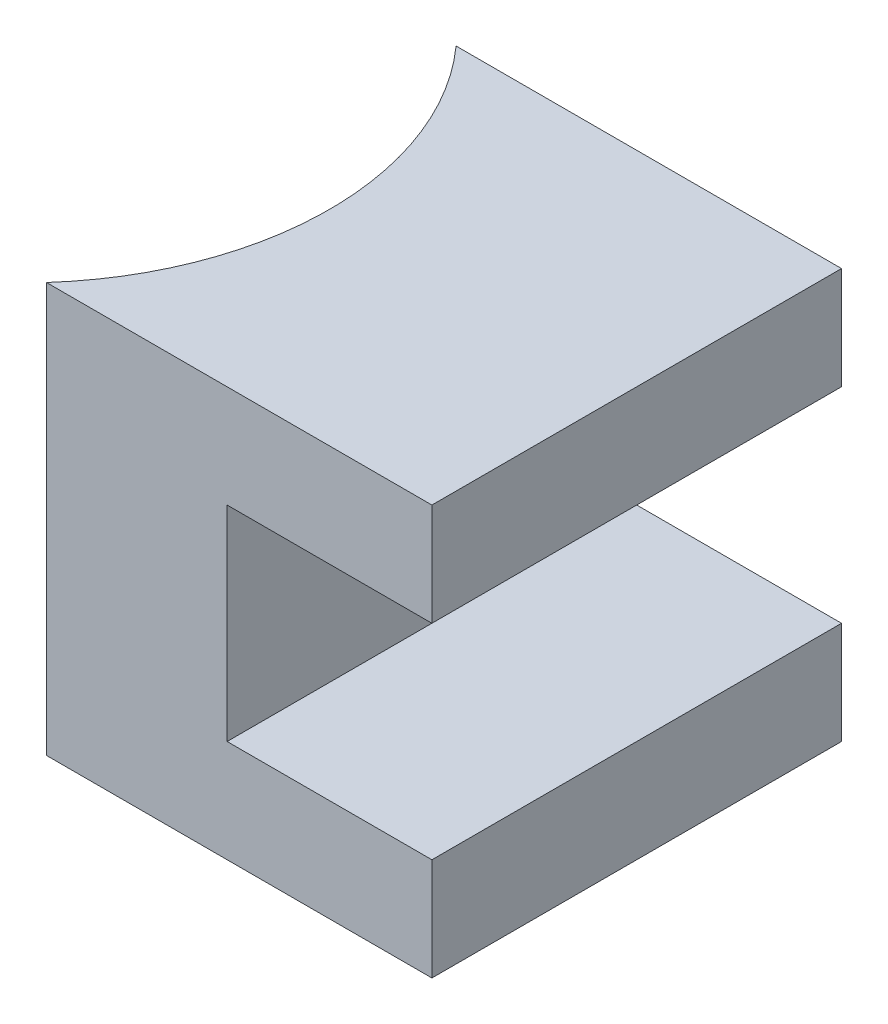
from build123d import *

# Parameters (mm, degrees)
EXTRUDE_1_DEPTH          = 10
CUT_EXTRUDE_1_DEPTH      = 38.416573868
CUT_EXTRUDE_1_DEPTH_BACK = 38.416573868
SKETCH_3_W               = 15.208425039
SKETCH_3_H               = 10


with BuildPart() as part:
    # 草图2 → 凸台-拉伸1 (new, symmetric)
    with BuildSketch(Plane(origin=(0, 0, 0), x_dir=(1, 0, 0), z_dir=(0, 1, 0))):
        with BuildLine():
            Line((11.180339887, 10), (30, 10))
            Line((30, 10), (30, -10))
            Line((30, -10), (11.180339887, -10))
            ThreePointArc((11.180339887, -10), (15, 0), (11.180339887, 10))
        make_face()
    extrude(amount=EXTRUDE_1_DEPTH, both=True)

    # 草图3 → 切除-拉伸1 (cut, two sides: drawn at the far end of the back side and taken through both)
    with BuildSketch(Plane.XY.offset(10).offset(-CUT_EXTRUDE_1_DEPTH_BACK)):
        with Locations((27.60421252, 0)):
            Rectangle(SKETCH_3_W, SKETCH_3_H)
    extrude(amount=CUT_EXTRUDE_1_DEPTH + CUT_EXTRUDE_1_DEPTH_BACK, mode=Mode.SUBTRACT)


solid = part.part
